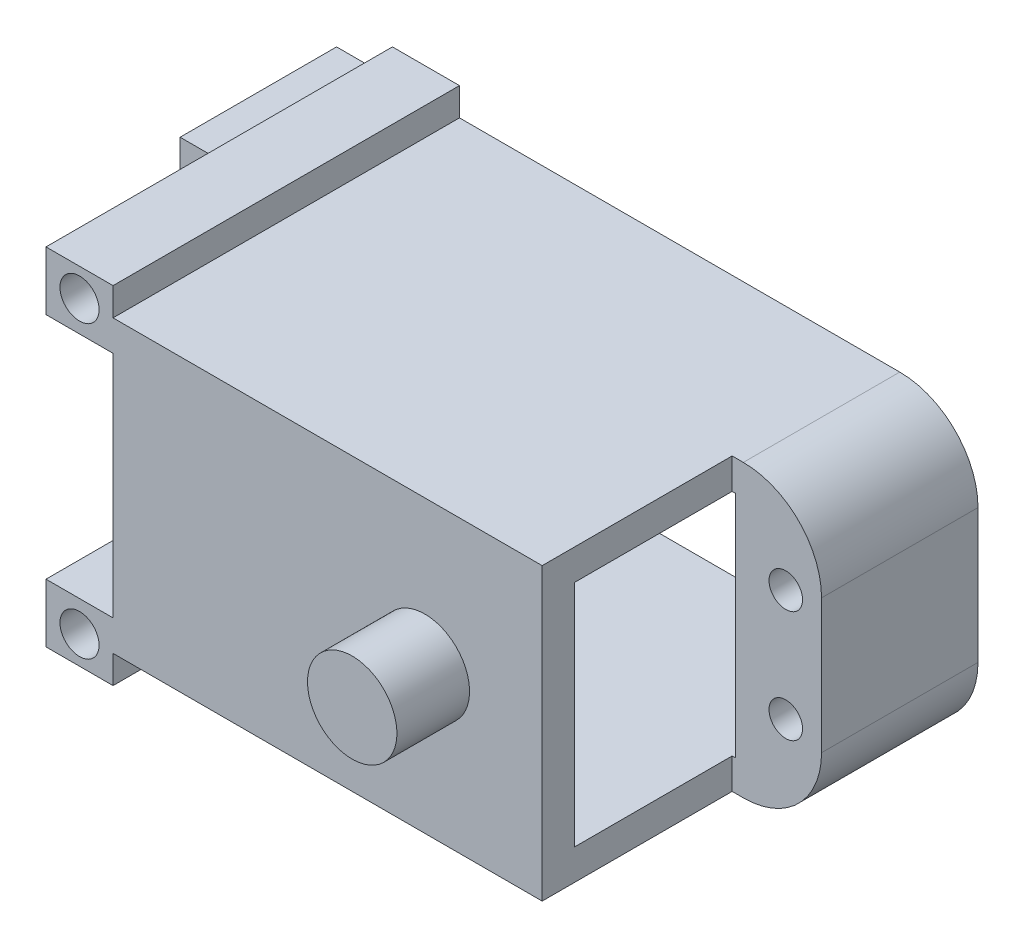
from build123d import *

# Parameters (mm, degrees)
SKETCH_1_W                  = 57.4
SKETCH_1_H                  = 28.5
EXTRUDE_1_DEPTH             = 12
SKETCH_2_W                  = 57.4
SKETCH_2_H                  = 26
EXTRUDE_2_DEPTH             = 19
SKETCH_3_W                  = 16.1
SKETCH_3_H                  = 20.5
CUT_EXTRUDE_1_DEPTH         = 7.7
SKETCH_4_W                  = 28.1
SKETCH_4_H                  = 20.5
CUT_EXTRUDE_2_DEPTH         = 41.7
SKETCH_5_W                  = 31
SKETCH_5_H                  = 20.5
CUT_EXTRUDE_3_DEPTH         = 0.3
CUT_EXTRUDE_4_DEPTH         = 2.9
SKETCH_7_W                  = 12
SKETCH_7_H                  = 2.5
CUT_EXTRUDE_5_DEPTH         = 46.4
CUT_EXTRUDE_6_DEPTH         = 7.7
CUT_EXTRUDE_7_DEPTH         = 14.1
CUT_EXTRUDE_8_DEPTH         = 3.3
SKETCH_11_W                 = 11
SKETCH_11_H                 = 12
EXTRUDE_3_DEPTH             = 2.5
SKETCH_12_W                 = 12
SKETCH_12_H                 = 2.75
EXTRUDE_4_DEPTH             = 6
SKETCH_13_W                 = 6
SKETCH_13_H                 = 12
EXTRUDE_5_DEPTH             = 2.5
SKETCH_14_W                 = 12
SKETCH_14_H                 = 5.25
EXTRUDE_6_DEPTH             = 6
SKETCH_15_W                 = 5
SKETCH_15_H                 = 2.5
CUT_EXTRUDE_9_DEPTH         = 45.999333328
SKETCH_16_W                 = 5
SKETCH_16_H                 = 2.5
CUT_EXTRUDE_10_DEPTH        = 45.999333328
SKETCH_17_W                 = 5
SKETCH_17_H                 = 26
EXTRUDE_7_DEPTH             = 2
SKETCH_19_W                 = 4
SKETCH_19_H                 = 6.5
HOLE_WIZARD_3_5_3_5_1_D     = 3.5
HOLE_WIZARD_3_5_3_5_1_DEPTH = 12
HOLE_WIZARD_3_0_3_3_D       = 3
HOLE_WIZARD_3_0_3_3_DEPTH   = 37.5
HOLE_WIZARD_3_5_3_5_3_D     = 3.5
FILLET_1_R                  = 7
EXTRUDE_START               = -19
SKETCH_28_W                 = 6
SKETCH_28_H                 = 5.25
SKETCH_28_R                 = 1.75
EXTRUDE_8_DEPTH             = 7


with BuildPart() as part:
    # Эскиз1 → Бобышка-Вытянуть1 (new body)
    with BuildSketch(Plane.XY.offset(12)):
        with Locations((0, 1.25)):
            Rectangle(SKETCH_1_W, SKETCH_1_H)
    extrude(amount=-EXTRUDE_1_DEPTH)

    # Эскиз2 → Бобышка-Вытянуть2 (add)
    with BuildSketch(Plane.XY.offset(12)):
        Rectangle(SKETCH_2_W, SKETCH_2_H)
    extrude(amount=EXTRUDE_2_DEPTH)

    # Эскиз3 → Вырез-Вытянуть1 (cut)
    with BuildSketch(Plane.ZY.offset(28.7)):
        with Locations((20.05, 0)):
            Rectangle(SKETCH_3_W, SKETCH_3_H)
    extrude(amount=-CUT_EXTRUDE_1_DEPTH, mode=Mode.SUBTRACT)

    # Эскиз4 → Вырез-Вытянуть2 (cut)
    with BuildSketch(Plane.ZY.offset(21)):
        with Locations((14.05, 0)):
            Rectangle(SKETCH_4_W, SKETCH_4_H)
    extrude(amount=-CUT_EXTRUDE_2_DEPTH, mode=Mode.SUBTRACT)

    # Эскиз5 → Вырез-Вытянуть3 (cut)
    with BuildSketch(Plane.ZY.offset(-20.7)):
        with Locations((15.5, 0)):
            Rectangle(SKETCH_5_W, SKETCH_5_H)
    extrude(amount=-CUT_EXTRUDE_3_DEPTH, mode=Mode.SUBTRACT)

    # Эскиз6 → Вырез-Вытянуть4 (cut)
    with BuildSketch(Plane.XY.offset(31)):
        Polygon((28.7, -13), (28.7, 13), (20.7, 13), (20.7, 10.25), (21, 10.25), (21, -10.25), (20.7, -10.25), (20.7, -13), align=None)
    extrude(amount=-CUT_EXTRUDE_4_DEPTH, mode=Mode.SUBTRACT)

    # Эскиз7 → Вырез-Вытянуть5 (cut)
    with BuildSketch(Plane(origin=(28.7, 0, 0), x_dir=(0, 0, -1), z_dir=(1, 0, 0))):
        with Locations((-6, 14.25)):
            Rectangle(SKETCH_7_W, SKETCH_7_H)
    extrude(amount=-CUT_EXTRUDE_5_DEPTH, mode=Mode.SUBTRACT)

    # Эскиз8 → Вырез-Вытянуть6 (cut)
    with BuildSketch(Plane.ZY.offset(28.7)):
        Polygon((12, -13), (31, -13), (31, 13), (12, 13), (12, 10.25), (28.1, 10.25), (28.1, -10.25), (12, -10.25), align=None)
    extrude(amount=-CUT_EXTRUDE_6_DEPTH, mode=Mode.SUBTRACT)

    # Эскиз9 → Вырез-Вытянуть7 (cut)
    with BuildSketch(Plane.XY.offset(28.1)):
        Polygon((28.7, -13), (28.7, 13), (20.7, 13), (20.7, 10.25), (21, 10.25), (21, -10.25), (20.7, -10.25), (20.7, -13), align=None)
    extrude(amount=-CUT_EXTRUDE_7_DEPTH, mode=Mode.SUBTRACT)

    # Эскиз10 → Вырез-Вытянуть8 (cut)
    with BuildSketch(Plane.ZY.offset(21)):
        Polygon((12, -13), (31, -13), (31, 13), (12, 13), (12, 10.25), (28.1, 10.25), (28.1, -10.25), (12, -10.25), align=None)
    extrude(amount=-CUT_EXTRUDE_8_DEPTH, mode=Mode.SUBTRACT)

    # Эскиз11 → Бобышка-Вытянуть3 (add)
    with BuildSketch(Plane.XZ.offset(13)):
        with Locations((-23.2, 6)):
            Rectangle(SKETCH_11_W, SKETCH_11_H)
    extrude(amount=EXTRUDE_3_DEPTH)

    # Эскиз12 → Бобышка-Вытянуть4 (add)
    with BuildSketch(Plane.ZY.offset(17.7)):
        with Locations((25, -11.625)):
            Rectangle(SKETCH_12_W, SKETCH_12_H)
    extrude(amount=EXTRUDE_4_DEPTH)

    # Эскиз13 → Бобышка-Вытянуть5 (add)
    with BuildSketch(Plane.XZ.offset(13)):
        with Locations((-20.7, 25)):
            Rectangle(SKETCH_13_W, SKETCH_13_H)
    extrude(amount=EXTRUDE_5_DEPTH)

    # Эскиз14 → Бобышка-Вытянуть6 (add)
    with BuildSketch(Plane.ZY.offset(17.7)):
        with Locations((25, 12.875)):
            Rectangle(SKETCH_14_W, SKETCH_14_H)
    extrude(amount=EXTRUDE_6_DEPTH)

    # Эскиз15 → Вырез-Вытянуть9 (cut, through all)
    with BuildSketch(Plane(origin=(0, 0, 0), x_dir=(-1, 0, 0), z_dir=(0, 0, -1))):
        with Locations((26.2, -14.25)):
            Rectangle(SKETCH_15_W, SKETCH_15_H)
    extrude(amount=-CUT_EXTRUDE_9_DEPTH, mode=Mode.SUBTRACT)

    # Эскиз16 → Вырез-Вытянуть10 (cut, through all)
    with BuildSketch(Plane(origin=(0, 0, 0), x_dir=(-1, 0, 0), z_dir=(0, 0, -1))):
        with Locations((26.2, 14.25)):
            Rectangle(SKETCH_16_W, SKETCH_16_H)
    extrude(amount=-CUT_EXTRUDE_10_DEPTH, mode=Mode.SUBTRACT)

    # Эскиз17 → Бобышка-Вытянуть7 (add)
    with BuildSketch(Plane.XY.offset(12)):
        with Locations((-26.2, 0)):
            Rectangle(SKETCH_17_W, SKETCH_17_H)
    extrude(amount=EXTRUDE_7_DEPTH)

    # Эскиз19 → Повернуть1 (revolve)
    with BuildSketch(Plane.XZ, mode=Mode.PRIVATE) as revolve_1_sk:
        with Locations((12.2, 34.25)):
            Rectangle(SKETCH_19_W, SKETCH_19_H)
    revolve(revolve_1_sk.sketch.rotate(Axis((10.2, 0, 37.5), (0, 0, -1)), 180), axis=Axis((10.2, 0, 37.5), (0, 0, -1)))

    # Диаметр отверстия Ø3.5 (3.5)1
    with Locations(Plane.XY.offset(31)):
        with Locations((-20.7, 13), (-20.7, -13)):
            Hole(HOLE_WIZARD_3_5_3_5_1_D / 2, depth=HOLE_WIZARD_3_5_3_5_1_DEPTH)

    # Диаметр отверстия Ø3.0 (3)3
    with Locations(Plane(origin=(0, 0, 0), x_dir=(-1, 0, 0), z_dir=(0, 0, -1))):
        with Locations((-25.5, -5), (-25.5, 5), (25.5, -5), (25.5, 5)):
            Hole(HOLE_WIZARD_3_0_3_3_D / 2, depth=HOLE_WIZARD_3_0_3_3_DEPTH)

    # Диаметр отверстия Ø3.5 (3.5)3 (through all)
    with Locations(Plane.XY.offset(12)):
        with Locations((-20.7, 13), (-20.7, -13)):
            Hole(HOLE_WIZARD_3_5_3_5_3_D / 2)

    # Скругление1
    fillet_1_edges = [part.edges().sort_by_distance(p)[0] for p in [
        (28.7, 13, 7),
        (28.7, -13, 7),
    ]]
    fillet(fillet_1_edges, radius=FILLET_1_R)

    # Эскиз28 → Бобышка-Вытянуть8 (add)
    # profile 1 of 2: a face of its own
    with BuildSketch(Plane.XY.offset(31).offset(EXTRUDE_START)):
        with Locations((-20.7, 12.875)):
            Rectangle(SKETCH_28_W, SKETCH_28_H)
        with Locations((-20.7, 13)):
            Circle(SKETCH_28_R, mode=Mode.SUBTRACT)
    # profile 2 of 2: a face of its own
    with BuildSketch(Plane.XY.offset(31).offset(EXTRUDE_START)):
        with Locations((-20.7, -12.875)):
            Rectangle(SKETCH_28_W, SKETCH_28_H)
        with Locations((-20.7, -13)):
            Circle(SKETCH_28_R, mode=Mode.SUBTRACT)
    extrude(amount=EXTRUDE_8_DEPTH)


solid = part.part
